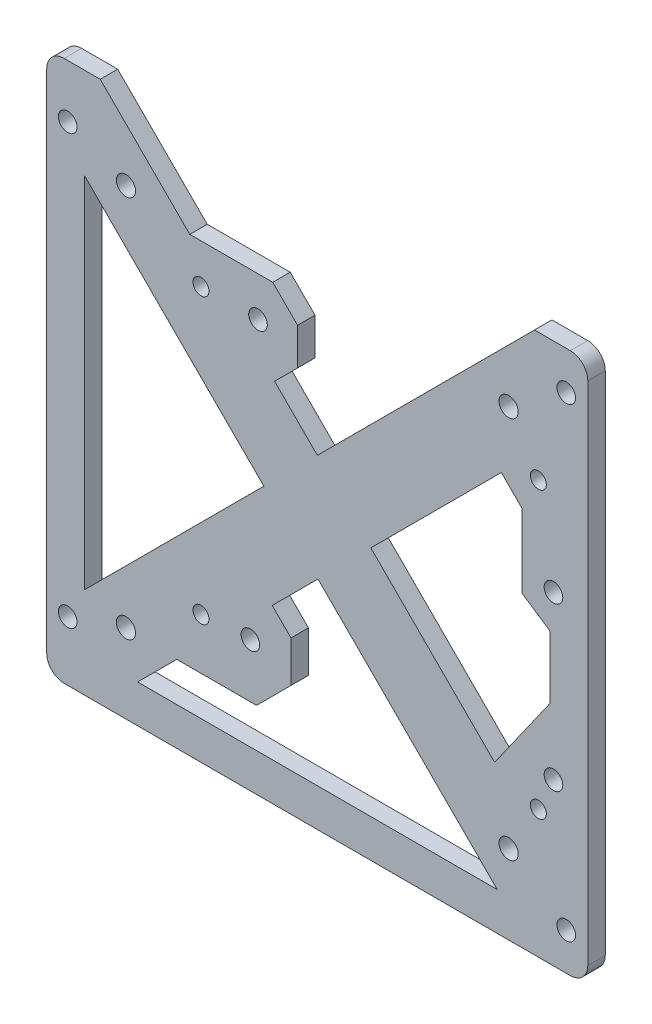
from build123d import *

# Parameters (mm, degrees)
SKETCH1_W           = 92.97433
SKETCH1_H           = 93
BOSS_EXTRUDE1_DEPTH = 3
FILLET1_R           = 3
CUT_EXTRUDE1_DEPTH  = 3
SKETCH3_R           = 1.6
SKETCH3_R_2         = 1.65
SKETCH3_R_3         = 1.375
CUT_EXTRUDE2_DEPTH  = 3
SKETCH4_R           = 1.6
SKETCH4_R_2         = 1.65
SKETCH4_R_3         = 1.375
CUT_EXTRUDE3_DEPTH  = 3


with BuildPart() as part:
    # Sketch1 → Boss-Extrude1 (new body)
    with BuildSketch(Plane.XY):
        Rectangle(SKETCH1_W, SKETCH1_H)
    extrude(amount=BOSS_EXTRUDE1_DEPTH)

    # Fillet1
    fillet1_edges = [part.edges().sort_by_distance(p)[0] for p in [
        (46.487165, -46.5, 1.5),
        (-46.487165, -46.5, 1.5),
        (-46.487165, 46.5, 1.5),
        (46.487165, 46.5, 1.5),
    ]]
    fillet(fillet1_edges, radius=FILLET1_R)

    # Sketch2 → Cut-Extrude1 (cut)
    with BuildSketch(Plane.XY.offset(3)):
        Polygon((-39.987165, 30.80761), (-39.987165, -30.80761), (-9.179568981, 0), align=None)
        Polygon((-37.295165, 46.5), (-21.908517975, 31.113359908), (-7.648517975, 31.113359908), (-3.384663123, 26.849506978), (-3.384663123, 20.489506978), (-7.331622093, 16.54254623), (0.01788969, 9.193037759), (37.324835, 46.5), align=None)
        Polygon((30.474058677, -21.263117504), (39.987165, -7.74491836), (39.987165, 3.02508164), (35.150146737, 6.279640646), (35.150146737, 18.919640646), (31.628754168, 22.441031617), (9.199332158, 0.011599428), align=None)
        Polygon((-24.13996688, -33.24619021), (-30.87162192, -39.977848283), (30.93837808, -39.977358271), (0.122892986, -9.161887063), (-7.74013265, -17.024916241), (-4.514413398, -20.250634039), (-4.514413398, -27.320634039), (-10.43996688, -33.24619021), align=None)
    extrude(amount=-CUT_EXTRUDE1_DEPTH, mode=Mode.SUBTRACT)

    # Sketch3 → Cut-Extrude2 (cut)
    with BuildSketch(Plane.XY.offset(3)):
        with Locations((-42.887165, 37.38)):
            Circle(SKETCH3_R)
        with Locations((-32.877165, 32.89)):
            Circle(SKETCH3_R_2)
        with Locations((-19.987165, 24.3)):
            Circle(SKETCH3_R_3)
        with Locations((-10.187165, 24.3)):
            Circle(SKETCH3_R)
    extrude(amount=-CUT_EXTRUDE2_DEPTH, mode=Mode.SUBTRACT)

    # Sketch4 → Cut-Extrude3 (cut)
    with BuildSketch(Plane.XY.offset(3)):
        with Locations((42.777165, -40.07)):
            Circle(SKETCH4_R)
        with Locations((32.877165, -32.89)):
            Circle(SKETCH4_R_2)
        with Locations((37.987165, -24.5)):
            Circle(SKETCH4_R_3)
        with Locations((40.587165, -18.8)):
            Circle(SKETCH4_R)
        with Locations((-42.887165, -36.27)):
            Circle(SKETCH4_R)
        with Locations((-32.877165, -32.89)):
            Circle(SKETCH4_R_2)
        with Locations((-19.987165, -24.5)):
            Circle(SKETCH4_R_3)
        with Locations((-11.487165, -24)):
            Circle(SKETCH4_R)
        with Locations((42.777165, 39.9)):
            Circle(SKETCH4_R)
        with Locations((32.877165, 32.89)):
            Circle(SKETCH4_R_2)
        with Locations((37.987165, 24.5)):
            Circle(SKETCH4_R_3)
        with Locations((40.587165, 9.1)):
            Circle(SKETCH4_R)
    extrude(amount=-CUT_EXTRUDE3_DEPTH, mode=Mode.SUBTRACT)


solid = part.part
